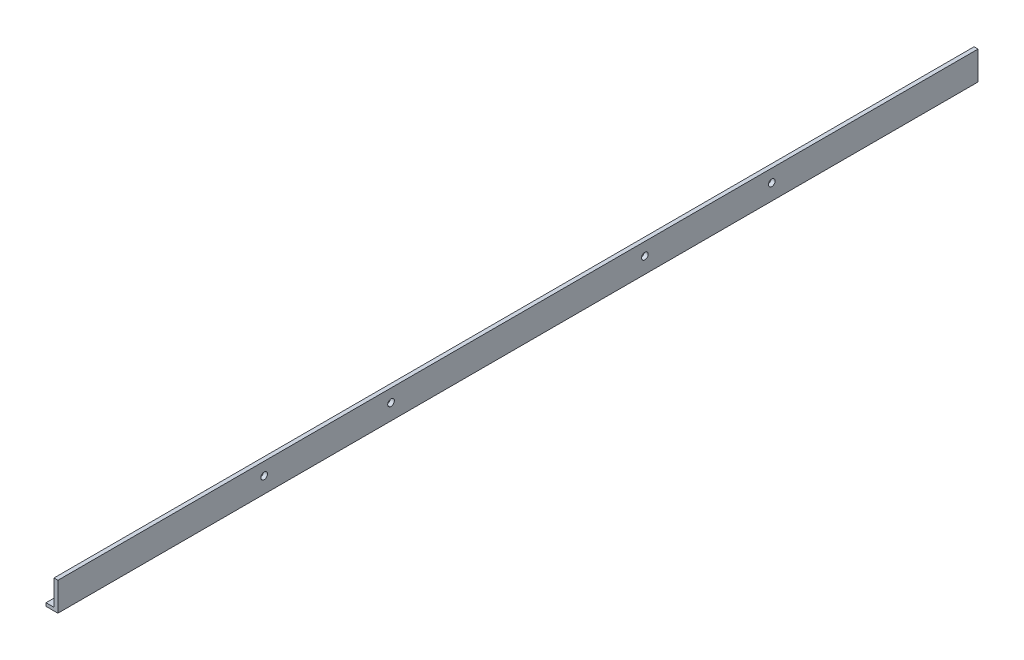
from build123d import *

# Parameters (mm, degrees)
EXTRUDE_1_DEPTH    = 580
HOLE_WIZARD_M5_1_D = 4.2


with BuildPart() as part:
    # 草图1 → 凸台-拉伸1 (new body)
    with BuildSketch(Plane.XY):
        Polygon((0, 0), (0, 18), (-2.5, 18), (-2.5, 2), (-7.5, 2), (-7.5, 0), align=None)
    extrude(amount=EXTRUDE_1_DEPTH)

    # M5 螺纹孔1 (through all)
    with Locations(Plane.ZY.offset(2.5)):
        with Locations((130, 10), (210, 10), (370, 10), (450, 10)):
            Hole(HOLE_WIZARD_M5_1_D / 2)


solid = part.part
